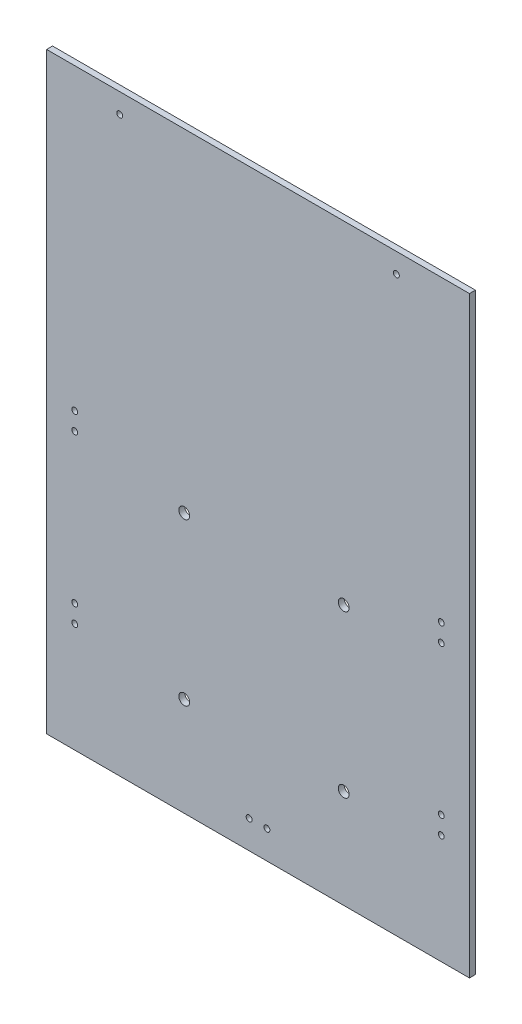
from build123d import *

# Parameters (mm, degrees)
SKETCH1_W           = 204
SKETCH1_H           = 300
BOSS_EXTRUDE1_DEPTH = 3
SKETCH2_R           = 2.75
CUT_EXTRUDE1_DEPTH  = 3
SKETCH4_W           = 3
SKETCH4_H           = 300
BOSS_EXTRUDE2_DEPTH = 5
SKETCH5_W           = 3
SKETCH5_H           = 300
BOSS_EXTRUDE3_DEPTH = 5
SKETCH3_R           = 1.5
CUT_EXTRUDE2_DEPTH  = 10
SKETCH9_R           = 1.5
CUT_EXTRUDE3_DEPTH  = 10
CUT_EXTRUDE4_DEPTH  = 10


with BuildPart() as part:
    # Sketch1 → Boss-Extrude1 (new body)
    with BuildSketch(Plane.XY):
        Rectangle(SKETCH1_W, SKETCH1_H)
    extrude(amount=BOSS_EXTRUDE1_DEPTH)

    # Sketch2 → Cut-Extrude1 (cut)
    with BuildSketch(Plane.XY.offset(3)):
        with Locations((-37.346869525, -18.322190961)):
            Circle(SKETCH2_R)
        with Locations((43.346869525, -18.322190961)):
            Circle(SKETCH2_R)
        with Locations((43.346869525, -100)):
            Circle(SKETCH2_R)
        with Locations((-37.346869525, -100)):
            Circle(SKETCH2_R)
    extrude(amount=-CUT_EXTRUDE1_DEPTH, mode=Mode.SUBTRACT)

    # Sketch4 → Boss-Extrude2 (add)
    with BuildSketch(Plane.ZY.offset(102)):
        with Locations((1.5, 0)):
            Rectangle(SKETCH4_W, SKETCH4_H)
    extrude(amount=BOSS_EXTRUDE2_DEPTH)

    # Sketch5 → Boss-Extrude3 (add)
    with BuildSketch(Plane(origin=(102, 0, 0), x_dir=(0, 0, -1), z_dir=(1, 0, 0))):
        with Locations((-1.5, 0)):
            Rectangle(SKETCH5_W, SKETCH5_H)
    extrude(amount=BOSS_EXTRUDE3_DEPTH)

    # Sketch3 → Cut-Extrude2 (cut)
    with BuildSketch(Plane.XY.offset(3)):
        with Locations((92.747048823, -10.253799858)):
            Circle(SKETCH3_R)
        with Locations((92.747048823, -1.253799858)):
            Circle(SKETCH3_R)
        with Locations((92.747048823, -94.618676634)):
            Circle(SKETCH3_R)
        with Locations((92.747048823, -85.618676634)):
            Circle(SKETCH3_R)
        with Locations(Location((-92.747048823, -85.618676634, 0), (0, 0, 180))):
            Circle(SKETCH3_R)
        with Locations(Location((-92.747048823, -94.618676634, 0), (0, 0, 180))):
            Circle(SKETCH3_R)
        with Locations(Location((-92.747048823, -1.253799858, 0), (0, 0, 180))):
            Circle(SKETCH3_R)
        with Locations(Location((-92.747048823, -10.253799858, 0), (0, 0, 180))):
            Circle(SKETCH3_R)
    extrude(amount=-CUT_EXTRUDE2_DEPTH, mode=Mode.SUBTRACT)

    # Sketch9 → Cut-Extrude3 (cut)
    with BuildSketch(Plane.XY.offset(3)):
        with Locations((-4.5, -135.747048823)):
            Circle(SKETCH9_R)
        with Locations((4.5, -135.747048823)):
            Circle(SKETCH9_R)
    extrude(amount=-CUT_EXTRUDE3_DEPTH, mode=Mode.SUBTRACT)

    # Sketch10 → Cut-Extrude4 (cut)
    with BuildSketch(Plane.XY.offset(3)):
        with BuildLine():
            ThreePointArc((-70, 138.5), (-68.939339828, 138.939339828), (-68.5, 140))
            Line((-68.5, 140), (-70, 140))
            Line((-70, 140), (-70, 138.5))
        make_face()
        with BuildLine():
            Line((-70, 140), (-68.5, 140))
            ThreePointArc((-68.5, 140), (-68.939339828, 141.060660172), (-70, 141.5))
            Line((-70, 141.5), (-70, 140))
        make_face()
        with BuildLine():
            ThreePointArc((-70, 141.5), (-71.060660172, 141.060660172), (-71.5, 140))
            Line((-71.5, 140), (-70, 140))
            Line((-70, 140), (-70, 141.5))
        make_face()
        with BuildLine():
            Line((-70, 140), (-71.5, 140))
            ThreePointArc((-71.5, 140), (-71.060660172, 138.939339828), (-70, 138.5))
            Line((-70, 138.5), (-70, 140))
        make_face()
        with BuildLine():
            ThreePointArc((70, 138.5), (71.060660172, 138.939339828), (71.5, 140))
            Line((71.5, 140), (70, 140))
            Line((70, 140), (70, 138.5))
        make_face()
        with BuildLine():
            Line((70, 140), (71.5, 140))
            ThreePointArc((71.5, 140), (71.060660172, 141.060660172), (70, 141.5))
            Line((70, 141.5), (70, 140))
        make_face()
        with BuildLine():
            Line((70, 138.5), (70, 140))
            Line((70, 140), (68.5, 140))
            ThreePointArc((68.5, 140), (68.939339828, 138.939339828), (70, 138.5))
        make_face()
        with BuildLine():
            Line((68.5, 140), (70, 140))
            Line((70, 140), (70, 141.5))
            ThreePointArc((70, 141.5), (68.939339828, 141.060660172), (68.5, 140))
        make_face()
    extrude(amount=-CUT_EXTRUDE4_DEPTH, mode=Mode.SUBTRACT)


solid = part.part
